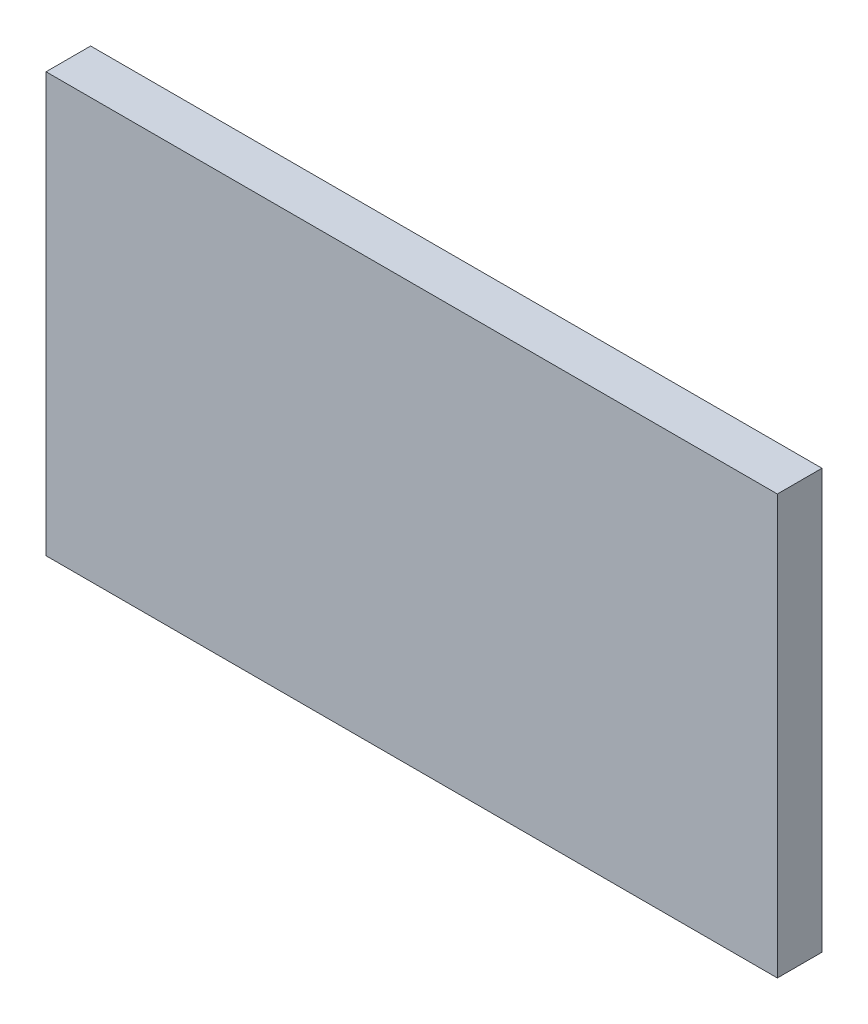
from build123d import *

# Parameters (mm, degrees)
ESQUISSE1_W        = 16.4
ESQUISSE1_H        = 9.4
BOSS_EXTRU_1_DEPTH = 1


with BuildPart() as part:
    # Esquisse1 → Boss.-Extru.1 (new body)
    with BuildSketch(Plane.XY):
        with Locations((8.2, 4.7)):
            Rectangle(ESQUISSE1_W, ESQUISSE1_H)
    extrude(amount=BOSS_EXTRU_1_DEPTH)


solid = part.part
